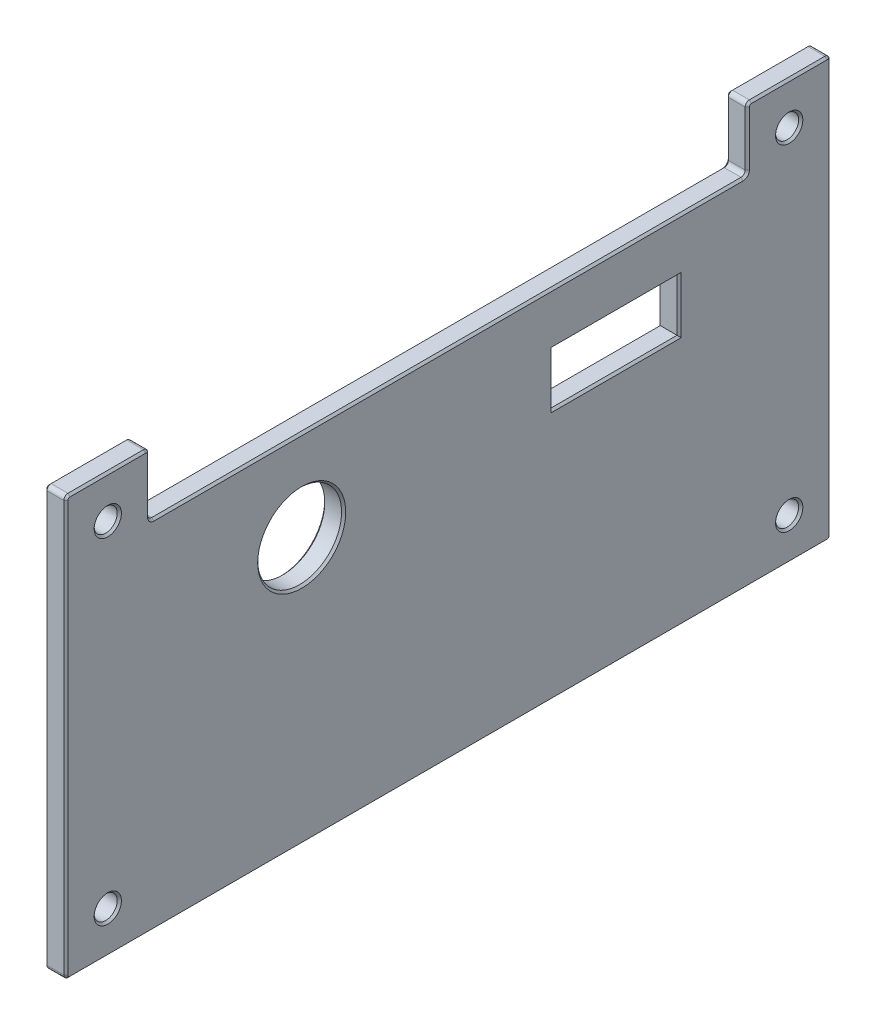
from build123d import *

# Parameters (mm, degrees)
SKETCH_1_W          = 73
SKETCH_1_H          = 34
EXTRUDE_1_DEPTH     = 2
SKETCH_2_R          = 4
SKETCH_2_W          = 12
SKETCH_2_H          = 5
CUT_EXTRUDE_1_DEPTH = 2
SKETCH_3_W          = 8
SKETCH_3_H          = 6
EXTRUDE_2_DEPTH     = 2
SKETCH_4_R          = 1.1
CUT_EXTRUDE_2_DEPTH = 2
FILLET_1_R          = 0.4
CHAMFER_1_SIZE      = 0.2


with BuildPart() as part:
    # 草图1 → 凸台-拉伸1 (new body)
    with BuildSketch(Plane(origin=(0, 0, 0), x_dir=(0, 0, -1), z_dir=(1, 0, 0))):
        with Locations((36.5, 17)):
            Rectangle(SKETCH_1_W, SKETCH_1_H)
    extrude(amount=EXTRUDE_1_DEPTH)

    # 草图2 → 切除-拉伸1 (cut)
    with BuildSketch(Plane(origin=(2, 0, 0), x_dir=(0, 0, -1), z_dir=(1, 0, 0))):
        with Locations((22.5, 25.4)):
            Circle(SKETCH_2_R)
        with Locations((52.5, 26.5)):
            Rectangle(SKETCH_2_W, SKETCH_2_H)
    extrude(amount=-CUT_EXTRUDE_1_DEPTH, mode=Mode.SUBTRACT)

    # 草图3 → 凸台-拉伸2 (add)
    with BuildSketch(Plane.ZY):
        with Locations((-69, 37)):
            Rectangle(SKETCH_3_W, SKETCH_3_H)
        with Locations((-4, 37)):
            Rectangle(SKETCH_3_W, SKETCH_3_H)
    extrude(amount=-EXTRUDE_2_DEPTH)

    # 草图4 → 切除-拉伸2 (cut)
    with BuildSketch(Plane(origin=(2, 0, 0), x_dir=(0, 0, -1), z_dir=(1, 0, 0))):
        with Locations((4, 36)):
            Circle(SKETCH_4_R)
        with Locations((69, 36)):
            Circle(SKETCH_4_R)
        with Locations((69, 4)):
            Circle(SKETCH_4_R)
        with Locations((4, 4)):
            Circle(SKETCH_4_R)
    extrude(amount=-CUT_EXTRUDE_2_DEPTH, mode=Mode.SUBTRACT)

    # 圆角1
    fillet_1_edges = [part.edges().sort_by_distance(p)[0] for p in [
        (1, 40, -73),
        (1, 40, -65),
        (1, 34, -65),
        (1, 40, 0),
        (1, 34, -8),
        (1, 40, -8),
        (1, 0, -73),
        (1, 0, 0),
    ]]
    fillet(fillet_1_edges, radius=FILLET_1_R)

    # 倒角1
    chamfer_1_edges = [part.edges().sort_by_distance(p)[0] for p in [
        (2, 0.117157288, -72.882842712),
        (2, 39.882842712, -72.882842712),
        (2, 39.882842712, -65.117157288),
        (2, 39.882842712, -7.882842712),
        (2, 39.882842712, -0.117157288),
        (0, 34.117157288, -8.117157288),
        (2, 34.117157288, -8.117157288),
        (0, 34.117157288, -64.882842712),
        (2, 34.117157288, -64.882842712),
        (0, 26.5, -46.5),
        (0, 29, -52.5),
        (0, 26.5, -58.5),
        (0, 24, -52.5),
        (2, 26.5, -46.5),
        (2, 24, -52.5),
        (2, 26.5, -58.5),
        (2, 29, -52.5),
        (0, 25.4, -18.5),
        (2, 25.4, -18.5),
        (0, 4, -2.9),
        (2, 4, -2.9),
        (0, 4, -67.9),
        (2, 4, -67.9),
        (0, 36, -67.9),
        (2, 36, -67.9),
        (0, 36, -2.9),
        (2, 36, -2.9),
        (0, 20, 0),
        (2, 20, 0),
        (0, 40, -4),
        (0, 37, -8),
        (0, 34, -36.5),
        (0, 37, -65),
        (0, 40, -69),
        (0, 20, -73),
        (0, 0, -36.5),
        (0, 0.117157288, -0.117157288),
        (0, 0.117157288, -72.882842712),
        (0, 39.882842712, -72.882842712),
        (0, 39.882842712, -65.117157288),
        (0, 39.882842712, -7.882842712),
        (0, 39.882842712, -0.117157288),
        (2, 40, -4),
        (2, 0, -36.5),
        (2, 20, -73),
        (2, 40, -69),
        (2, 37, -65),
        (2, 34, -36.5),
        (2, 37, -8),
        (2, 0.117157288, -0.117157288),
    ]]
    chamfer(chamfer_1_edges, length=CHAMFER_1_SIZE)


solid = part.part
